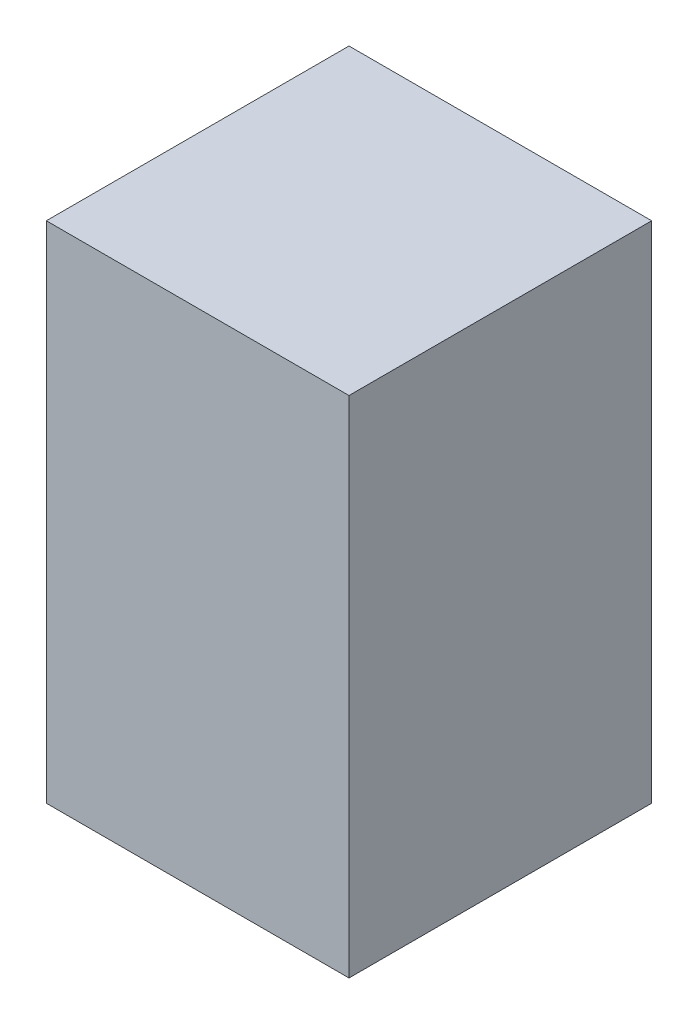
from build123d import *

# Parameters (mm, degrees)
SKETCH1_W           = 6
SKETCH1_H           = 6
BOSS_EXTRUDE1_DEPTH = 10


with BuildPart() as part:
    # Sketch1 → Boss-Extrude1 (new body)
    with BuildSketch(Plane(origin=(0, 0, 0), x_dir=(1, 0, 0), z_dir=(0, 1, 0))):
        with Locations((-3, 0.662162162)):
            Rectangle(SKETCH1_W, SKETCH1_H)
    extrude(amount=BOSS_EXTRUDE1_DEPTH)


solid = part.part
